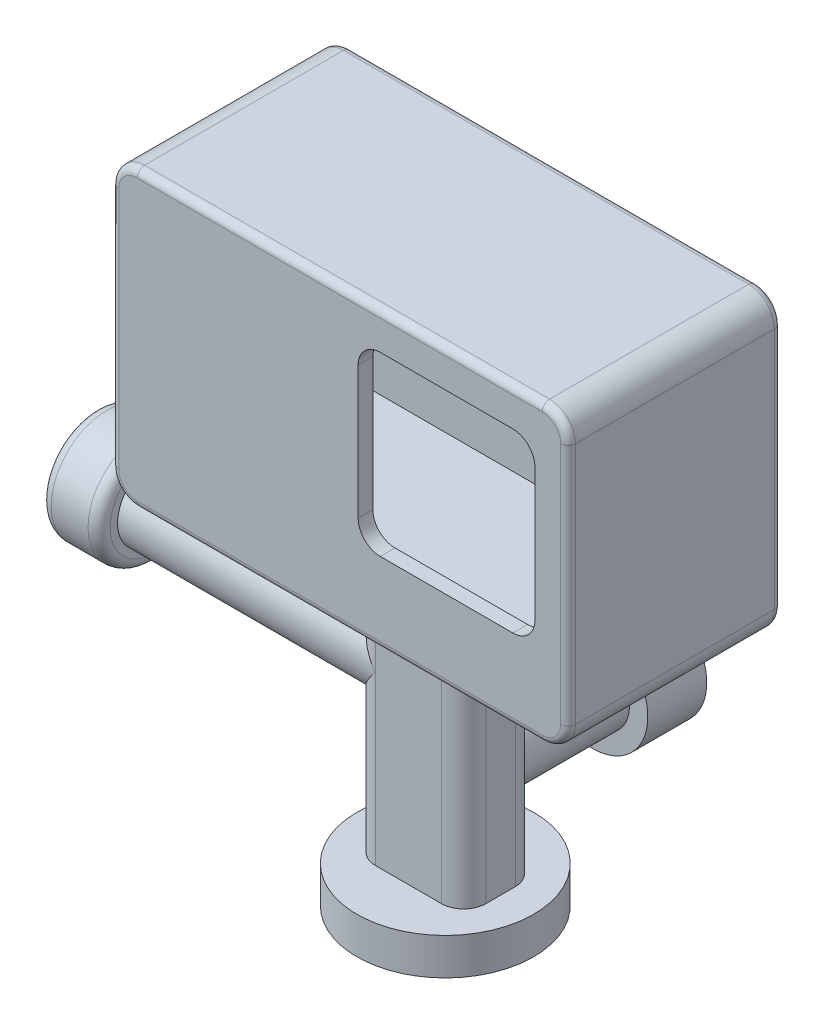
from build123d import *

# Parameters (mm, degrees)
BOSS_EXTRUDE1_DEPTH      = 27
BOSS_EXTRUDE2_START      = 2
BOSS_EXTRUDE2_DEPTH      = 2
SKETCH3_W                = 15
SKETCH3_H                = 10
BOSS_EXTRUDE3_DEPTH      = 40
SKETCH4_R                = 12
BOSS_EXTRUDE4_DEPTH      = 5
FILLET2_R                = 3
BOSS_EXTRUDE5_DEPTH      = 32
BOSS_EXTRUDE5_DEPTH_BACK = 10
SKETCH5_R                = 5
SKETCH6_R                = 7.5
BOSS_EXTRUDE6_DEPTH      = 8
SKETCH7_R                = 5
BOSS_EXTRUDE7_DEPTH      = 5
BOSS_EXTRUDE8_DEPTH      = 1
FILLET3_R                = 1
FILLET4_R                = 1.5
FILLET5_R                = 1
BOSS_EXTRUDE9_DEPTH      = 15
BOSS_EXTRUDE9_DEPTH_BACK = 5
SKETCH9_R                = 5
SKETCH11_R               = 7.5
BOSS_EXTRUDE10_DEPTH     = 8


with BuildPart() as part:
    # Sketch1 → Boss-Extrude1 (new body)
    with BuildSketch(Plane.XY):
        with BuildLine():
            Line((31, 80), (31, 47))
            ThreePointArc((31, 47), (29.974873734, 44.525126266), (27.5, 43.5))
            Line((27.5, 43.5), (-27.5, 43.5))
            ThreePointArc((-27.5, 43.5), (-29.974873734, 44.525126266), (-31, 47))
            Line((-31, 47), (-31, 80))
            ThreePointArc((-31, 80), (-29.974873734, 82.474873734), (-27.5, 83.5))
            Line((-27.5, 83.5), (27.5, 83.5))
            ThreePointArc((27.5, 83.5), (29.974873734, 82.474873734), (31, 80))
        make_face()
        with BuildLine():
            Line((29.5, 80), (29.5, 47))
            ThreePointArc((29.5, 47), (28.914213562, 45.585786438), (27.5, 45))
            Line((27.5, 45), (-27.5, 45))
            ThreePointArc((-27.5, 45), (-28.914213562, 45.585786438), (-29.5, 47))
            Line((-29.5, 47), (-29.5, 80))
            ThreePointArc((-29.5, 80), (-28.914213562, 81.414213562), (-27.5, 82))
            Line((-27.5, 82), (27.5, 82))
            ThreePointArc((27.5, 82), (28.914213562, 81.414213562), (29.5, 80))
        make_face(mode=Mode.SUBTRACT)
    extrude(amount=-BOSS_EXTRUDE1_DEPTH)

    # Sketch2 → Boss-Extrude2 (add)
    with BuildSketch(Plane.XY.offset(BOSS_EXTRUDE2_START)):
        with BuildLine():
            Line((27.5, 83.5), (-27.5, 83.5))
            ThreePointArc((-27.5, 83.5), (-29.974873734, 82.474873734), (-31, 80))
            Line((-31, 80), (-31, 47))
            ThreePointArc((-31, 47), (-29.974873734, 44.525126266), (-27.5, 43.5))
            Line((-27.5, 43.5), (27.5, 43.5))
            ThreePointArc((27.5, 43.5), (29.974873734, 44.525126266), (31, 47))
            Line((31, 47), (31, 80))
            ThreePointArc((31, 80), (29.974873734, 82.474873734), (27.5, 83.5))
        make_face()
        with BuildLine():
            Line((23.5, 78.5), (5.5, 78.5))
            ThreePointArc((5.5, 78.5), (3.378679656, 77.621320344), (2.5, 75.5))
            Line((2.5, 75.5), (2.5, 57.5))
            ThreePointArc((2.5, 57.5), (3.378679656, 55.378679656), (5.5, 54.5))
            Line((5.5, 54.5), (23.5, 54.5))
            ThreePointArc((23.5, 54.5), (25.621320344, 55.378679656), (26.5, 57.5))
            Line((26.5, 57.5), (26.5, 75.5))
            ThreePointArc((26.5, 75.5), (25.621320344, 77.621320344), (23.5, 78.5))
        make_face(mode=Mode.SUBTRACT)
    extrude(amount=-BOSS_EXTRUDE2_DEPTH)

    # Sketch3 → Boss-Extrude3 (add)
    with BuildSketch(Plane.XZ.offset(-43.5)):
        with Locations((0, -12.332332162)):
            Rectangle(SKETCH3_W, SKETCH3_H)
    extrude(amount=BOSS_EXTRUDE3_DEPTH)

    # Sketch4 → Boss-Extrude4 (add)
    with BuildSketch(Plane.XZ.offset(-3.5)):
        with Locations(Location((0, -12.332332162, 0), (0, 0, 270))):
            Circle(SKETCH4_R)
    extrude(amount=-BOSS_EXTRUDE4_DEPTH)

    # Fillet2
    fillet2_edges = [part.edges().sort_by_distance(p)[0] for p in [
        (-7.5, 26, -7.332332162),
        (7.5, 26, -7.332332162),
        (7.5, 26, -17.332332162),
        (-7.5, 26, -17.332332162),
    ]]
    fillet(fillet2_edges, radius=FILLET2_R)

    # Sketch5 → Boss-Extrude5 (add, two sides: drawn at the far end of the back side and taken through both)
    with BuildSketch(Plane.ZY.offset(7.5).offset(-BOSS_EXTRUDE5_DEPTH_BACK)):
        with Locations((-12.332332162, 31.227787974)):
            Circle(SKETCH5_R)
    extrude(amount=BOSS_EXTRUDE5_DEPTH + BOSS_EXTRUDE5_DEPTH_BACK)

    # Sketch6 → Boss-Extrude6 (add)
    with BuildSketch(Plane.ZY.offset(39.5)):
        with Locations((-12.332332162, 31.227787974)):
            Circle(SKETCH6_R)
    extrude(amount=BOSS_EXTRUDE6_DEPTH)

    # Sketch7 → Boss-Extrude7 (add)
    with BuildSketch(Plane.ZY.offset(31)):
        with Locations((-12.5, 71.5)):
            Circle(SKETCH7_R)
        with Locations((-12.5, 56.5)):
            Circle(SKETCH7_R)
    extrude(amount=BOSS_EXTRUDE7_DEPTH)

    # Fillet3
    fillet3_edges = [part.edges().sort_by_distance(p)[0] for p in [
        (-29.974873734, 82.474873734, -27),
        (-31, 63.5, -27),
        (-29.974873734, 44.525126266, -27),
        (0, 43.5, -27),
        (29.974873734, 44.525126266, -27),
        (31, 63.5, -27),
        (29.974873734, 82.474873734, -27),
        (29.974873734, 82.474873734, 2),
        (0, 83.5, 2),
        (-29.974873734, 82.474873734, 2),
        (-31, 63.5, 2),
        (-29.974873734, 44.525126266, 2),
        (0, 43.5, 2),
        (29.974873734, 44.525126266, 2),
        (31, 63.5, 2),
        (0, 83.5, -27),
    ]]
    fillet(fillet3_edges, radius=FILLET3_R)

    # Fillet4
    fillet4_edges = [part.edges().sort_by_distance(p)[0] for p in [
        (-39.5, 31.227787974, -19.832332162),
        (-47.5, 31.227787974, -19.832332162),
    ]]
    fillet(fillet4_edges, radius=FILLET4_R)

    # Fillet5
    fillet5_edges = [part.edges().sort_by_distance(p)[0] for p in [
        (-36, 71.5, -17.5),
        (-36, 56.5, -17.5),
    ]]
    fillet(fillet5_edges, radius=FILLET5_R)

    # Sketch9 → Boss-Extrude9 (add, two sides: drawn at the far end of the back side and taken through both)
    with BuildSketch(Plane(origin=(0, 0, -17.332332162), x_dir=(-1, 0, 0), z_dir=(0, 0, -1)).offset(-BOSS_EXTRUDE9_DEPTH_BACK)):
        with Locations((0, 19.5)):
            Circle(SKETCH9_R)
    extrude(amount=BOSS_EXTRUDE9_DEPTH + BOSS_EXTRUDE9_DEPTH_BACK)

    # Sketch11 → Boss-Extrude10 (add)
    with BuildSketch(Plane(origin=(0, 0, -32.332332162), x_dir=(-1, 0, 0), z_dir=(0, 0, -1))):
        with Locations((0, 19.5)):
            Circle(SKETCH11_R)
    extrude(amount=BOSS_EXTRUDE10_DEPTH)


with BuildPart() as body_2:
    # Sketch8 → Boss-Extrude8 (new body)
    with BuildSketch(Plane(origin=(0, 0, -27), x_dir=(-1, 0, 0), z_dir=(0, 0, -1))):
        with BuildLine():
            Line((-29, 80), (-29, 47))
            ThreePointArc((-29, 47), (-28.560660172, 45.939339828), (-27.5, 45.5))
            Line((-27.5, 45.5), (27.5, 45.5))
            ThreePointArc((27.5, 45.5), (28.560660172, 45.939339828), (29, 47))
            Line((29, 47), (29, 80))
            ThreePointArc((29, 80), (28.560660172, 81.060660172), (27.5, 81.5))
            Line((27.5, 81.5), (-27.5, 81.5))
            ThreePointArc((-27.5, 81.5), (-28.560660172, 81.060660172), (-29, 80))
        make_face()
    extrude(amount=-BOSS_EXTRUDE8_DEPTH)


solid = Compound([part.part, body_2.part])
